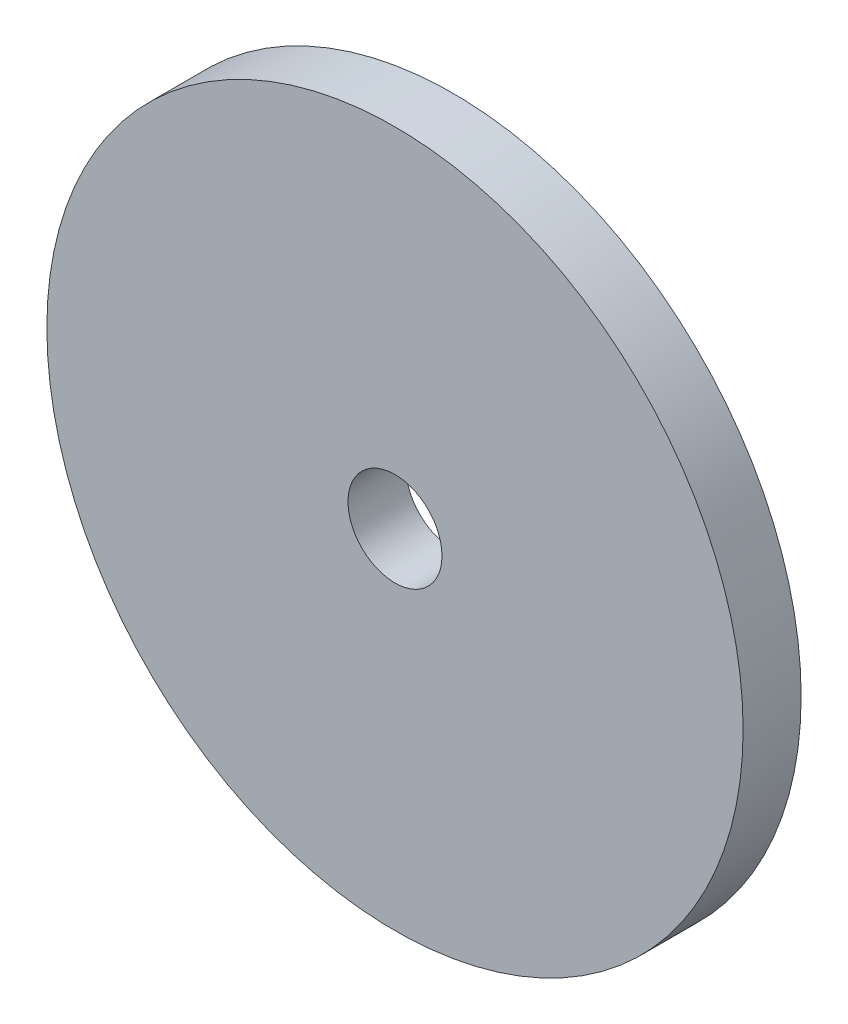
from build123d import *

# Parameters (mm, degrees)
SKETCH1_R           = 30
SKETCH1_R_2         = 4.05
BOSS_EXTRUDE1_DEPTH = 5


with BuildPart() as part:
    # Sketch1 → Boss-Extrude1 (new body)
    with BuildSketch(Plane.XY):
        Circle(SKETCH1_R)
        Circle(SKETCH1_R_2, mode=Mode.SUBTRACT)
    extrude(amount=BOSS_EXTRUDE1_DEPTH)


solid = part.part
